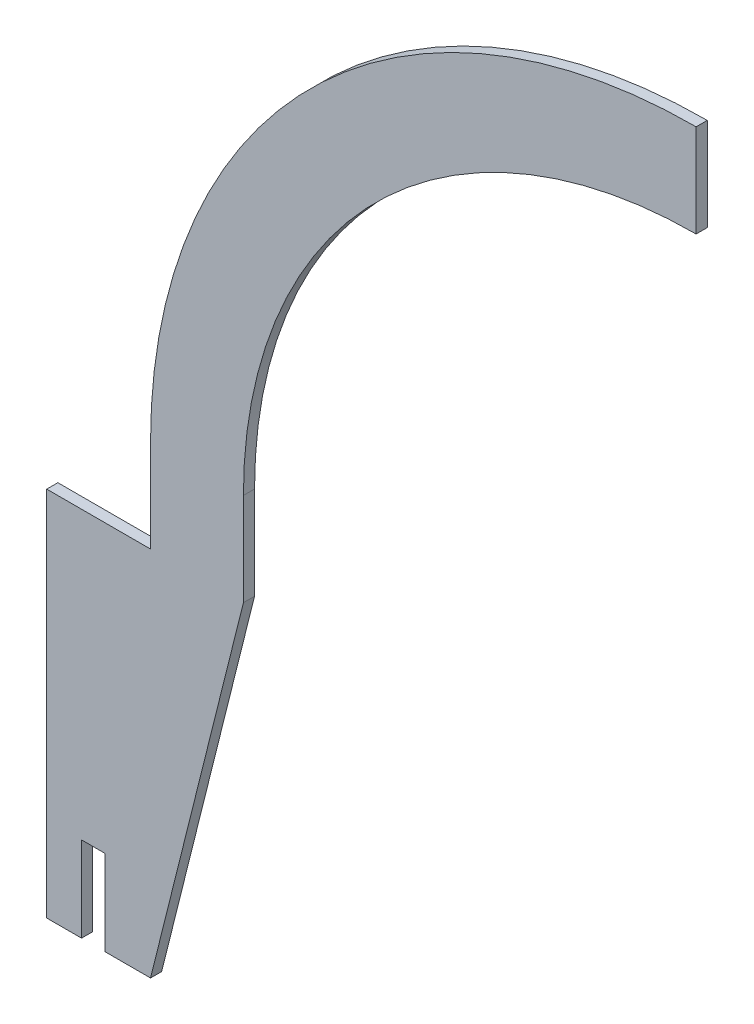
from build123d import *

# Parameters (mm, degrees)
BOSS_EXTRUDE1_DEPTH = 18.25625


with BuildPart() as part:
    # Sketch1 → Boss-Extrude1 (new body)
    with BuildSketch(Plane.XY):
        with BuildLine():
            Line((-1245.720896666, 421.537507263), (-1416.065070695, 421.537507263))
            Line((-1416.065070695, 421.537507263), (-1416.065070695, -188.062492737))
            Line((-1416.065070695, -188.062492737), (-1358.915070695, -188.062492737))
            Line((-1358.915070695, -188.062492737), (-1358.915070695, -48.362492737))
            Line((-1358.915070695, -48.362492737), (-1320.815070695, -48.362492737))
            Line((-1320.815070695, -48.362492737), (-1320.815070695, -188.062492737))
            Line((-1320.815070695, -188.062492737), (-1245.720896666, -188.062492737))
            Line((-1245.720896666, -188.062492737), (-1093.320896666, 421.537507263))
            Line((-1093.320896666, 421.537507263), (-1093.320896666, 573.937507263))
            ThreePointArc((-1093.320896666, 573.937507263), (-875.715879749, 1099.282490346), (-350.370896666, 1316.887507263))
            Line((-350.370896666, 1316.887507263), (-350.370896666, 1469.287507263))
            ThreePointArc((-350.370896666, 1469.287507263), (-983.478953202, 1207.045563799), (-1245.720896666, 573.937507263))
            Line((-1245.720896666, 573.937507263), (-1245.720896666, 421.537507263))
        make_face()
    extrude(amount=BOSS_EXTRUDE1_DEPTH)


solid = part.part
